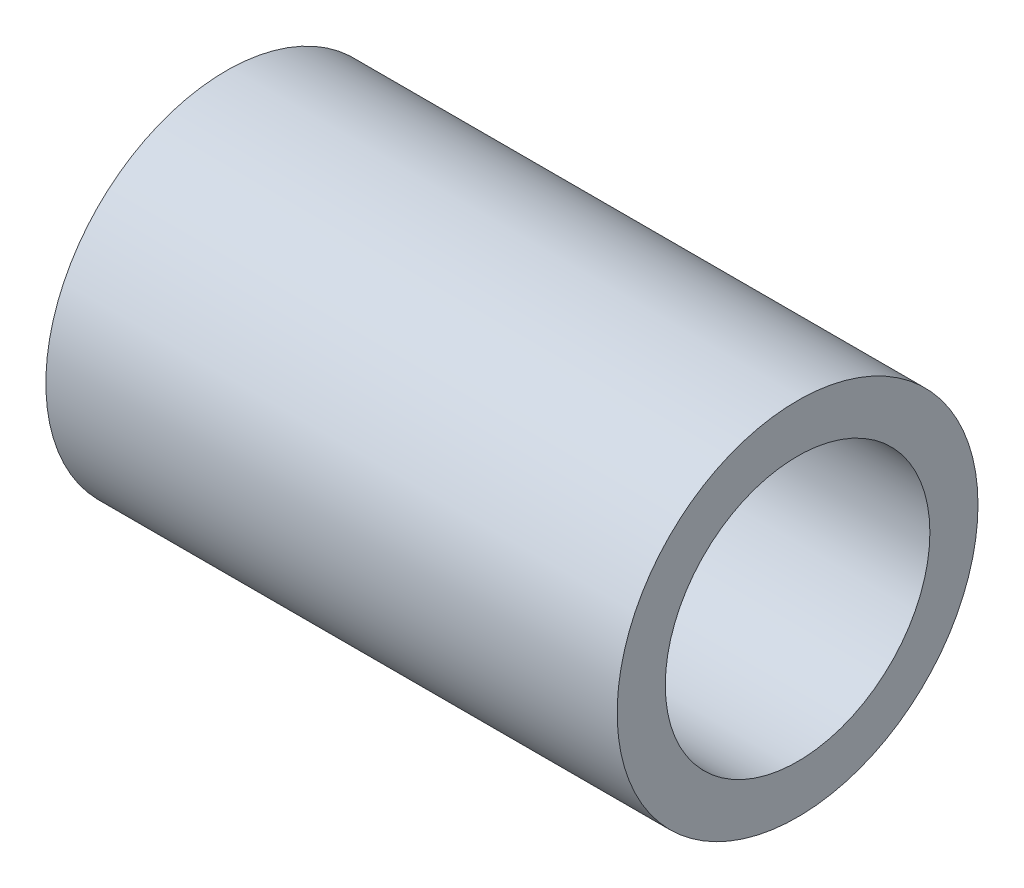
from build123d import *

# Parameters (mm, degrees)
SKETCH_1_R      = 3
SKETCH_1_R_2    = 2.2
EXTRUDE_1_DEPTH = 9.5


with BuildPart() as part:
    # ｽｹｯﾁ1 → ﾎﾞｽ - 押し出し1 (new body)
    with BuildSketch(Plane(origin=(0, 0, 0), x_dir=(0, 0, -1), z_dir=(1, 0, 0))):
        with Locations((-38.757351486, 27.300364138)):
            Circle(SKETCH_1_R)
        with Locations((-38.757351486, 27.300364138)):
            Circle(SKETCH_1_R_2, mode=Mode.SUBTRACT)
    extrude(amount=EXTRUDE_1_DEPTH)


solid = part.part
